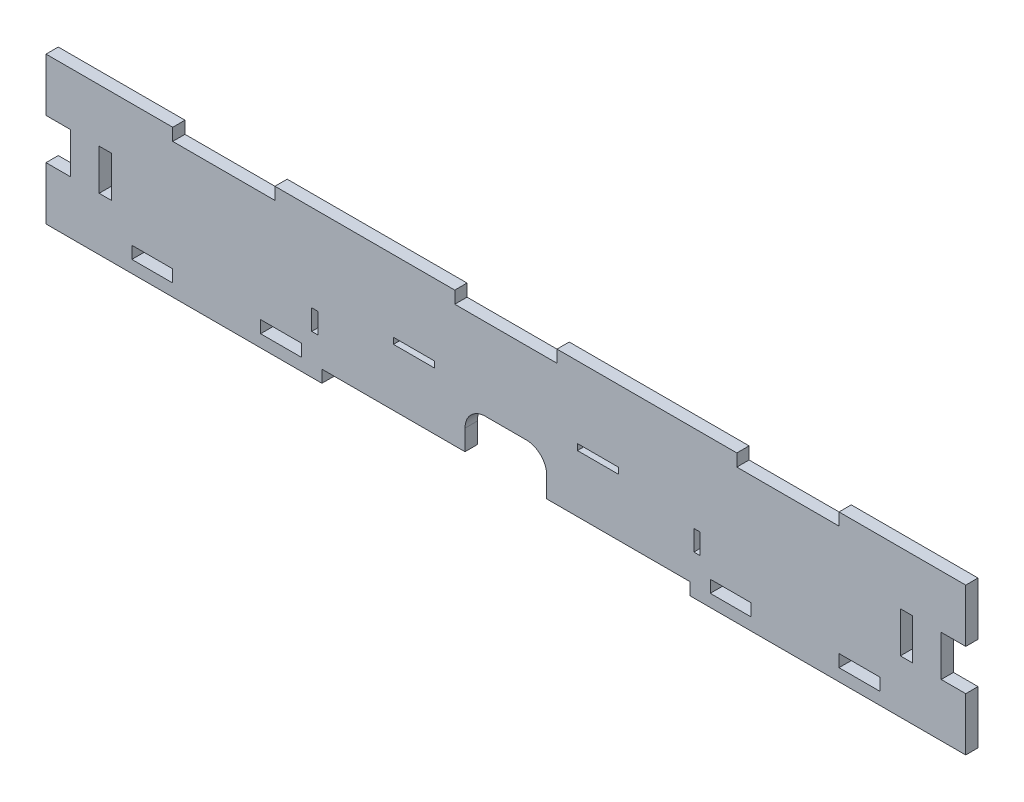
from build123d import *

# Parameters (mm, degrees)
SKETCH_1_W      = 20
SKETCH_1_H      = 6
SKETCH_1_W_2    = 6
SKETCH_1_H_2    = 20
SKETCH_1_W_3    = 3
SKETCH_1_H_3    = 10
SKETCH_1_H_4    = 3
EXTRUDE_1_DEPTH = 6
FILLET_1_R      = 10
FILLET_2_R      = 10


with BuildPart() as part:
    # Эскиз1 → Бобышка-Вытянуть1 (new body)
    with BuildSketch(Plane.XY):
        Polygon((0, 60), (0, 66), (62, 66), (62, 60), (112, 60), (112, 66), (200, 66), (200, 60), (250, 60), (250, 66), (338, 66), (338, 60), (388, 60), (388, 66), (450, 66), (450, 60), (450, 40), (438, 40), (438, 20), (450, 20), (450, 0), (450, -6), (315, -6), (315, 0), (245, 0), (245, 20), (205, 20), (205, 0), (135, 0), (135, -6), (0, -6), (0, 0), (0, 20), (12, 20), (12, 40), (0, 40), align=None)
        with Locations((115, 3)):
            Rectangle(SKETCH_1_W, SKETCH_1_H, mode=Mode.SUBTRACT)
        with Locations((335, 3)):
            Rectangle(SKETCH_1_W, SKETCH_1_H, mode=Mode.SUBTRACT)
        with Locations((29, 30)):
            Rectangle(SKETCH_1_W_2, SKETCH_1_H_2, mode=Mode.SUBTRACT)
        with Locations((421, 30)):
            Rectangle(SKETCH_1_W_2, SKETCH_1_H_2, mode=Mode.SUBTRACT)
        with Locations((398, 3)):
            Rectangle(SKETCH_1_W, SKETCH_1_H, mode=Mode.SUBTRACT)
        with Locations((52, 3)):
            Rectangle(SKETCH_1_W, SKETCH_1_H, mode=Mode.SUBTRACT)
        with Locations((318.5, 18.5)):
            Rectangle(SKETCH_1_W_3, SKETCH_1_H_3, mode=Mode.SUBTRACT)
        with Locations((131.5, 18.5)):
            Rectangle(SKETCH_1_W_3, SKETCH_1_H_3, mode=Mode.SUBTRACT)
        with Locations((180, 29.5)):
            Rectangle(SKETCH_1_W, SKETCH_1_H_4, mode=Mode.SUBTRACT)
        with Locations((270, 29.5)):
            Rectangle(SKETCH_1_W, SKETCH_1_H_4, mode=Mode.SUBTRACT)
    extrude(amount=EXTRUDE_1_DEPTH)

    # Скругление1
    fillet_1_edges = [part.edges().sort_by_distance(p)[0] for p in [
        (205, 20, 3),
    ]]
    fillet(fillet_1_edges, radius=FILLET_1_R)

    # Скругление2
    fillet_2_edges = [part.edges().sort_by_distance(p)[0] for p in [
        (245, 20, 3),
    ]]
    fillet(fillet_2_edges, radius=FILLET_2_R)


solid = part.part
